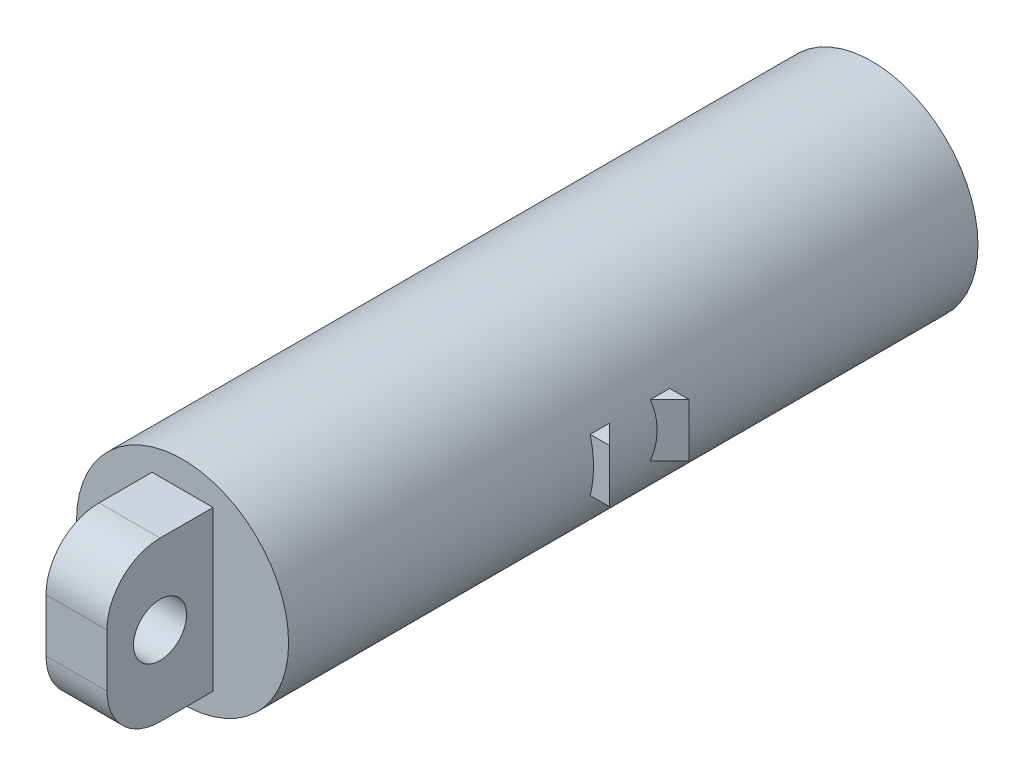
from build123d import *

# Parameters (mm, degrees)
SKETCH1_R               = 20
BOSS_EXTRUDE1_DEPTH     = 130
BOSS_EXTRUDE2_DEPTH     = 5
SKETCH3_R               = 5
BOSS_EXTRUDE3_DEPTH     = 10
SKETCH4_W               = 11.5
SKETCH4_H               = 30
BOSS_EXTRUDE4_DEPTH     = 20
FILLET1_R               = 10
CUT_EXTRUDE1_DEPTH      = 154.502646557
CUT_EXTRUDE1_DEPTH_BACK = 154.502646557
SKETCH5_R               = 5


with BuildPart() as part:
    # Sketch1 → Boss-Extrude1 (new body)
    with BuildSketch(Plane.XY):
        Circle(SKETCH1_R)
    extrude(amount=BOSS_EXTRUDE1_DEPTH)

    # Sketch2 → Boss-Extrude2 (add, symmetric)
    with BuildSketch(Plane(origin=(0, 0, 0), x_dir=(1, 0, 0), z_dir=(0, 1, 0))):
        Polygon((23, -72.5), (15.5, -65), (23, -57.5), (8, -57.5), (8, -72.5), align=None)
    extrude(amount=BOSS_EXTRUDE2_DEPTH, both=True)

    # Sketch3 → Boss-Extrude3 (add)
    with BuildSketch(Plane(origin=(0, 0, 0), x_dir=(-1, 0, 0), z_dir=(0, 0, -1))):
        with Locations(Location((0, 0, 0), (0, 0, 180))):
            Circle(SKETCH3_R)
    extrude(amount=BOSS_EXTRUDE3_DEPTH)

    # Sketch4 → Boss-Extrude4 (add)
    with BuildSketch(Plane.XY.offset(130)):
        Rectangle(SKETCH4_W, SKETCH4_H)
    extrude(amount=BOSS_EXTRUDE4_DEPTH)

    # Fillet1
    fillet1_edges = [part.edges().sort_by_distance(p)[0] for p in [
        (0, -15, 150),
        (0, 15, 150),
    ]]
    fillet(fillet1_edges, radius=FILLET1_R)

    # Sketch5 → Cut-Extrude1 (cut, two sides: drawn at the far end of the back side and taken through both)
    with BuildSketch(Plane(origin=(5.75, 0, 0), x_dir=(0, 0, -1), z_dir=(1, 0, 0)).offset(-CUT_EXTRUDE1_DEPTH_BACK)):
        with Locations(Location((-140, 0, 0), (0, 0, 90))):
            Circle(SKETCH5_R)
    extrude(amount=CUT_EXTRUDE1_DEPTH + CUT_EXTRUDE1_DEPTH_BACK, mode=Mode.SUBTRACT)


solid = part.part
